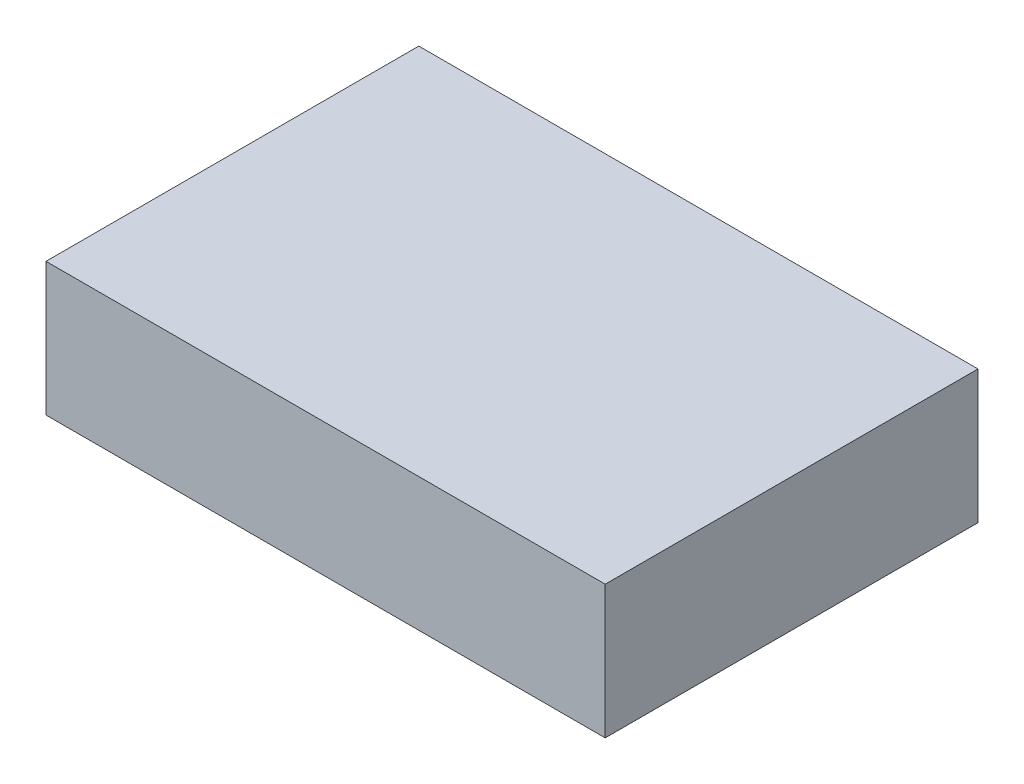
from build123d import *

# Parameters (mm, degrees)
SKETCH_1_W      = 21
SKETCH_1_H      = 14
EXTRUDE_1_DEPTH = 5


with BuildPart() as part:
    # 草图1 → 凸台-拉伸1 (new body)
    with BuildSketch(Plane(origin=(0, 0, 0), x_dir=(1, 0, 0), z_dir=(0, 1, 0))):
        Rectangle(SKETCH_1_W, SKETCH_1_H)
    extrude(amount=EXTRUDE_1_DEPTH)


solid = part.part
